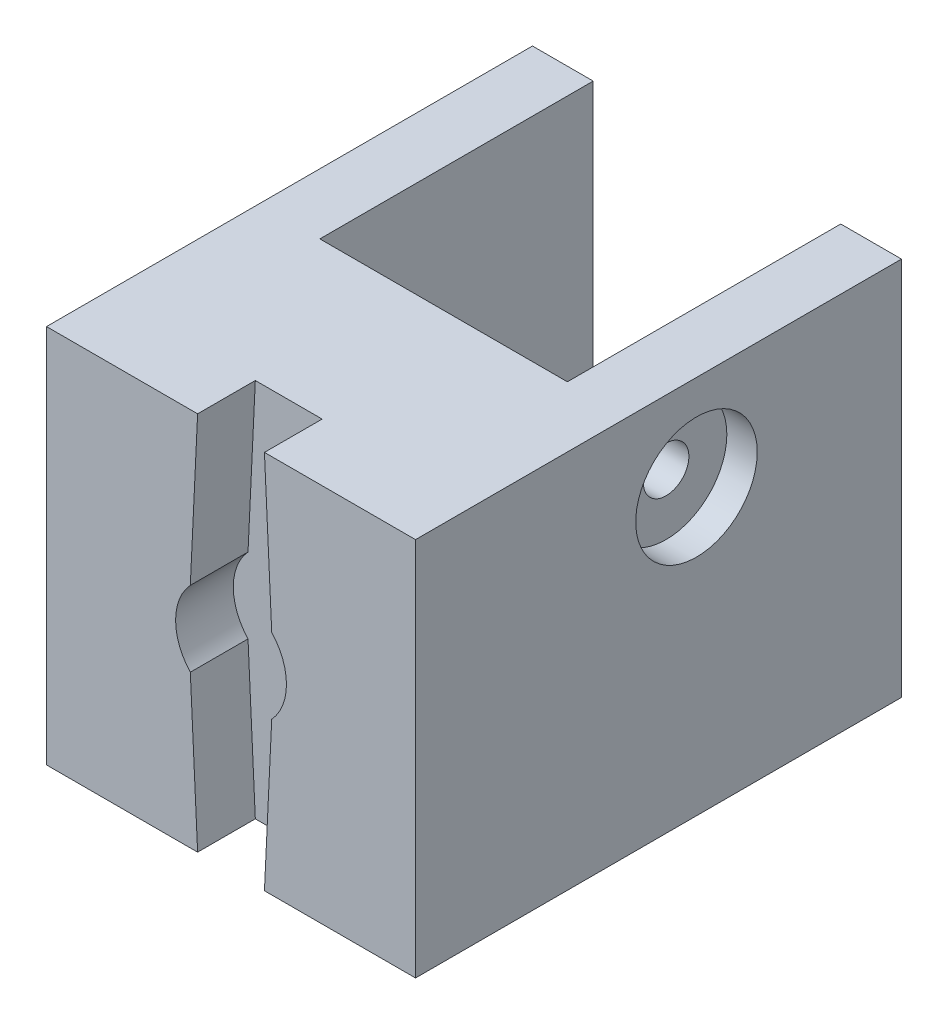
from build123d import *

# Parameters (mm, degrees)
EXTRUDE_THIN1_DEPTH = 25
SKETCH2_W           = 24.3
SKETCH2_H           = 25
BOSS_EXTRUDE1_DEPTH = 10
CUT_EXTRUDE1_DEPTH  = 3.8
SKETCH4_R           = 3.65
CUT_EXTRUDE2_DEPTH  = 3.8
SKETCH5_R           = 1.5
CUT_EXTRUDE3_DEPTH  = 37.892953257
SKETCH7_R           = 1.5
CUT_EXTRUDE4_DEPTH  = 37.892953257
SKETCH8_R           = 4
CUT_EXTRUDE5_DEPTH  = 2
SKETCH9_R           = 4
CUT_EXTRUDE6_DEPTH  = 2


with BuildPart() as part:
    # Sketch1 → Extrude-Thin1 (new body)
    with BuildSketch(Plane(origin=(0, 0, 0), x_dir=(1, 0, 0), z_dir=(0, 1, 0))):
        Polygon((-8.15, 18), (-8.15, 0), (8.15, 0), (8.15, 18), (12.15, 18), (12.15, -4), (-12.15, -4), (-12.15, 18), align=None)
    extrude(amount=EXTRUDE_THIN1_DEPTH)

    # Sketch2 → Boss-Extrude1 (add)
    with BuildSketch(Plane.XY.offset(4)):
        with Locations((0, 12.5)):
            Rectangle(SKETCH2_W, SKETCH2_H)
    extrude(amount=BOSS_EXTRUDE1_DEPTH)

    # Sketch3 → Cut-Extrude1 (cut)
    with BuildSketch(Plane.XY.offset(14)):
        with BuildLine():
            Line((-2.2, 25), (-2.8, 12.5))
            Line((-2.8, 12.5), (-2.2, 0))
            ThreePointArc((-2.2, 0), (0, -2.096932942), (2.2, 0))
            Line((2.2, 0), (2.8, 12.5))
            Line((2.8, 12.5), (2.2, 25))
            ThreePointArc((2.2, 25), (0, 27.096932942), (-2.2, 25))
        make_face()
    extrude(amount=-CUT_EXTRUDE1_DEPTH, mode=Mode.SUBTRACT)

    # Sketch4 → Cut-Extrude2 (cut)
    with BuildSketch(Plane.XY.offset(14)):
        with Locations((0, 12.5)):
            Circle(SKETCH4_R)
    extrude(amount=-CUT_EXTRUDE2_DEPTH, mode=Mode.SUBTRACT)

    # Sketch5 → Cut-Extrude3 (cut, through all)
    with BuildSketch(Plane.ZY.offset(-8.15)):
        with Locations((-4.5, 18.75)):
            Circle(SKETCH5_R)
    extrude(amount=-CUT_EXTRUDE3_DEPTH, mode=Mode.SUBTRACT)

    # Sketch7 → Cut-Extrude4 (cut, through all)
    with BuildSketch(Plane(origin=(-8.15, 0, 0), x_dir=(0, 0, -1), z_dir=(1, 0, 0))):
        with Locations((13.5, 6.25)):
            Circle(SKETCH7_R)
    extrude(amount=-CUT_EXTRUDE4_DEPTH, mode=Mode.SUBTRACT)

    # Sketch8 → Cut-Extrude5 (cut)
    with BuildSketch(Plane(origin=(12.15, 0, 0), x_dir=(0, 0, -1), z_dir=(1, 0, 0))):
        with Locations((4.5, 18.75)):
            Circle(SKETCH8_R)
    extrude(amount=-CUT_EXTRUDE5_DEPTH, mode=Mode.SUBTRACT)

    # Sketch9 → Cut-Extrude6 (cut)
    with BuildSketch(Plane.ZY.offset(12.15)):
        with Locations((-13.5, 6.25)):
            Circle(SKETCH9_R)
    extrude(amount=-CUT_EXTRUDE6_DEPTH, mode=Mode.SUBTRACT)


solid = part.part
